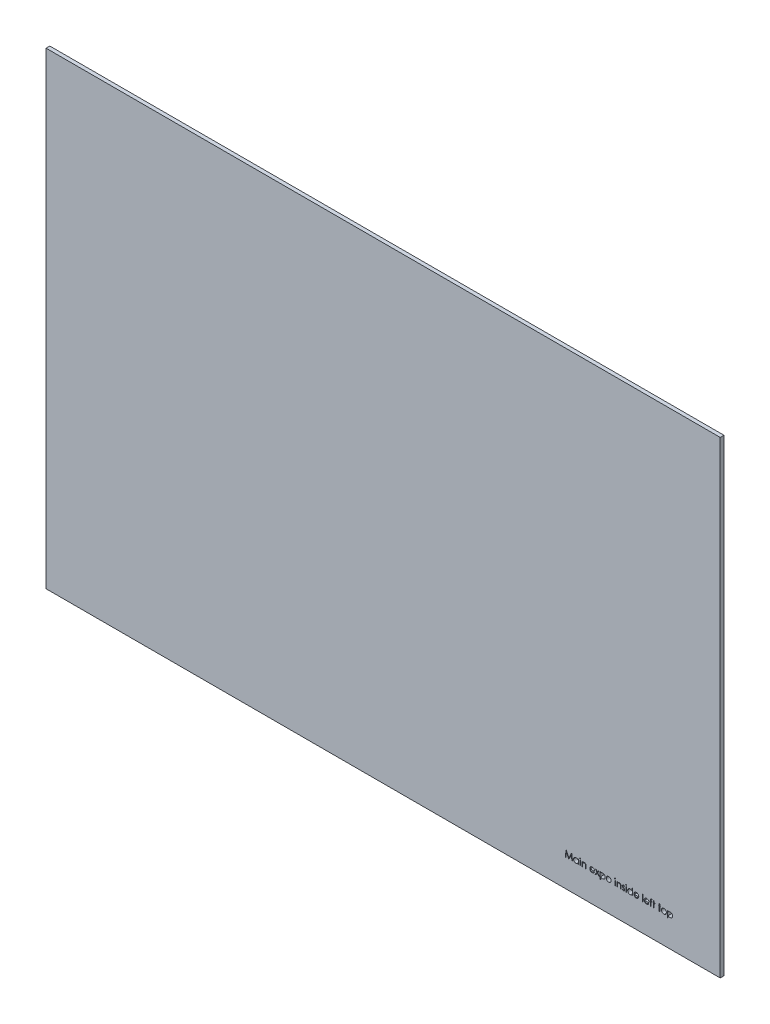
from build123d import *

# Parameters (mm, degrees)
SKETCH1_W           = 360
SKETCH1_H           = 250
BOSS_EXTRUDE1_DEPTH = 2
SKETCH2_W           = 0.314102564
SKETCH2_H           = 2.557692308
SKETCH2_H_2         = 3.58974359
CUT_EXTRUDE1_DEPTH  = 439.296703159


with BuildPart() as part:
    # Sketch1 → Boss-Extrude1 (new body)
    with BuildSketch(Plane.XY):
        with Locations((180, -125)):
            Rectangle(SKETCH1_W, SKETCH1_H)
    extrude(amount=BOSS_EXTRUDE1_DEPTH)

    # Sketch2 → Cut-Extrude1 (cut, through all)
    # profile 1 of 24: a face of its own
    with BuildSketch(Plane.XY.offset(2)):
        Polygon((277.252072298, -235.433998468), (277.714111561, -231.933998468), (277.758983356, -231.933998468), (279.203995375, -234.80579334), (280.645501786, -231.933998468), (280.691074702, -231.933998468), (281.155918452, -235.433998468), (280.840413645, -235.433998468), (280.505277427, -232.915568981), (279.241855952, -235.433998468), (279.171042651, -235.433998468), (277.902713324, -232.909960007), (277.568278228, -235.433998468), align=None)
    # profile 2 of 24: a face of its own
    with BuildSketch(Plane.XY.offset(2)):
        with BuildLine():
            Line((284.386687683, -232.87630616), (284.386687683, -235.433998468))
            Line((284.386687683, -235.433998468), (284.072585119, -235.433998468))
            Line((284.072585119, -235.433998468), (284.072585119, -234.991590616))
            add(Edge.make_bspline(
                [(284.072585119, -234.991590616), (284.005347564, -235.071041813), (283.896836613, -235.181571287), (283.730209022, -235.296205454), (283.601542743, -235.364396568), (283.466615537, -235.415520456), (283.276562681, -235.464940061), (283.128149824, -235.479677613), (283.027913645, -235.478870263)],
                knots=[0, 0, 0, 0, 0.262084975, 0.386269912, 0.507164597, 0.627300236, 0.748144942, 1, 1, 1, 1], degree=3))
            add(Edge.make_bspline(
                [(283.027913645, -235.478870263), (282.938884233, -235.478652163), (282.806617122, -235.467157755), (282.636550478, -235.426298283), (282.515276767, -235.384440708), (282.399604393, -235.328848321), (282.288544355, -235.262310223), (282.182671662, -235.183068527), (282.083600063, -235.092480738), (281.992368301, -234.99408569), (281.912306168, -234.889140147), (281.845556219, -234.778097885), (281.789724538, -234.662364559), (281.746771493, -234.541050289), (281.706094917, -234.370343108), (281.694587983, -234.237647452), (281.694379991, -234.148141096)],
                knots=[0, 0, 0, 0, 0.127433484, 0.189004127, 0.249930071, 0.310668454, 0.372328961, 0.43493911, 0.499575544, 0.564191208, 0.626735217, 0.688109334, 0.749293607, 0.810330528, 0.87190117, 1, 1, 1, 1], degree=3))
            add(Edge.make_bspline(
                [(281.694379991, -234.148141096), (281.694897644, -234.060323332), (281.705629119, -233.929708782), (281.74762495, -233.761976765), (281.791133917, -233.6426215), (281.846986264, -233.528281003), (281.914911523, -233.418877096), (281.994931434, -233.314107678), (282.087183624, -233.216436409), (282.187118445, -233.126215985), (282.294027191, -233.047806244), (282.405250366, -232.980091914), (282.522513782, -232.92642914), (282.644079362, -232.883054875), (282.815291997, -232.842375391), (282.948316117, -232.832231987), (283.03772935, -232.831434366)],
                knots=[0, 0, 0, 0, 0.12607881, 0.186904093, 0.247573935, 0.308003356, 0.369131898, 0.432033228, 0.496790794, 0.561610823, 0.624913866, 0.686726349, 0.748078833, 0.809582291, 0.871630743, 1, 1, 1, 1], degree=3))
            add(Edge.make_bspline(
                [(283.03772935, -232.831434366), (283.139922033, -232.831733335), (283.291665364, -232.8448534), (283.48366314, -232.898832335), (283.618326216, -232.952693968), (283.745462765, -233.024384784), (283.907385766, -233.147538925), (284.010655164, -233.2646055), (284.072585119, -233.349563372)],
                knots=[0, 0, 0, 0, 0.254653531, 0.376014554, 0.495255252, 0.614797719, 0.738105554, 1, 1, 1, 1], degree=3))
            Line((284.072585119, -233.349563372), (284.072585119, -232.87630616))
            Line((284.072585119, -232.87630616), (284.386687683, -232.87630616))
        make_face()
        with BuildLine():
            add(Edge.make_bspline(
                [(283.041936081, -233.14553693), (282.95143507, -233.145932168), (282.816059733, -233.160948644), (282.645034702, -233.217499023), (282.524091104, -233.274722843), (282.411422648, -233.346767088), (282.310727483, -233.433884314), (282.221191057, -233.533722615), (282.14585861, -233.645823734), (282.084557513, -233.766004447), (282.026697026, -233.933121454), (282.007328984, -234.064168549), (282.008482555, -234.151646705)],
                knots=[0, 0, 0, 0, 0.169593435, 0.252475515, 0.336244477, 0.419504521, 0.502035907, 0.584774648, 0.669846475, 0.754184866, 0.836658238, 1, 1, 1, 1], degree=3))
            add(Edge.make_bspline(
                [(282.008482555, -234.151646705), (282.009230547, -234.238555427), (282.025861954, -234.37008093), (282.085752876, -234.536882538), (282.146928248, -234.658141381), (282.223632911, -234.770725695), (282.312516833, -234.8724671), (282.414468441, -234.959951376), (282.527395322, -235.033209137), (282.648004451, -235.092296561), (282.817472942, -235.147668801), (282.950229177, -235.165187366), (283.039131593, -235.164767699)],
                knots=[0, 0, 0, 0, 0.162858895, 0.245483689, 0.330807139, 0.416493374, 0.499893203, 0.583048156, 0.667157852, 0.751311929, 0.833784789, 1, 1, 1, 1], degree=3))
            add(Edge.make_bspline(
                [(283.039131593, -235.164767699), (283.129443968, -235.164380238), (283.265068544, -235.148756764), (283.437901623, -235.092706986), (283.561687299, -235.034870204), (283.677003577, -234.963096296), (283.780502374, -234.879093414), (283.868014621, -234.781389392), (283.94222124, -234.674012206), (284.000343908, -234.556304006), (284.057878075, -234.386914004), (284.072103378, -234.251428565), (284.072585119, -234.160761289)],
                knots=[0, 0, 0, 0, 0.16866354, 0.252551924, 0.338239689, 0.423102661, 0.505556051, 0.586175656, 0.66713572, 0.74849918, 0.830452399, 1, 1, 1, 1], degree=3))
            add(Edge.make_bspline(
                [(284.072585119, -234.160761289), (284.072388303, -234.091233736), (284.063537475, -233.988177955), (284.032325324, -233.856005748), (284.000011707, -233.762563607), (283.957511767, -233.673928447), (283.906266338, -233.589464721), (283.84536025, -233.509611516), (283.775777732, -233.435468384), (283.699612476, -233.367842157), (283.619017968, -233.307477058), (283.533039145, -233.257891426), (283.443122377, -233.21683853), (283.349110027, -233.184223488), (283.215482041, -233.154547184), (283.112034639, -233.144518263), (283.041936081, -233.14553693)],
                knots=[0, 0, 0, 0, 0.129188088, 0.191218683, 0.251912818, 0.312507474, 0.373494434, 0.4351516, 0.498741474, 0.562095217, 0.624186567, 0.685475718, 0.746096815, 0.807611636, 0.869966581, 1, 1, 1, 1], degree=3))
        make_face(mode=Mode.SUBTRACT)
    # profile 3 of 24: a face of its own
    with BuildSketch(Plane.XY.offset(2)):
        with Locations((285.216815888, -234.155152314)):
            Rectangle(SKETCH2_W, SKETCH2_H)
    # profile 4 of 24: a face of its own
    with BuildSketch(Plane.XY.offset(2)):
        with BuildLine():
            Line((286.136687683, -232.87630616), (286.450790247, -232.87630616))
            Line((286.450790247, -232.87630616), (286.450790247, -233.337644301))
            add(Edge.make_bspline(
                [(286.450790247, -233.337644301), (286.514147051, -233.25543704), (286.615041829, -233.140516436), (286.772360868, -233.019955617), (286.892333415, -232.949820178), (287.017961898, -232.897028935), (287.193463826, -232.845438335), (287.33149762, -232.831910606), (287.423947298, -232.831434366)],
                knots=[0, 0, 0, 0, 0.273568781, 0.398988314, 0.519929781, 0.638110022, 0.756588901, 1, 1, 1, 1], degree=3))
            add(Edge.make_bspline(
                [(287.423947298, -232.831434366), (287.516322944, -232.832046141), (287.654199084, -232.847048615), (287.824770884, -232.909800423), (287.941385343, -232.972957906), (288.046513904, -233.051578813), (288.138838404, -233.143152808), (288.215201738, -233.248489907), (288.266399104, -233.346212811), (288.300124696, -233.432901641), (288.321357242, -233.507148383), (288.33938733, -233.589866537), (288.355022902, -233.680806125), (288.365583866, -233.780604317), (288.377216634, -233.930330894), (288.381057379, -234.047121861), (288.380277427, -234.127808564)],
                knots=[0, 0, 0, 0, 0.15117814, 0.223487984, 0.295542644, 0.366976255, 0.437130525, 0.507043616, 0.578559734, 0.616613545, 0.658756237, 0.704491226, 0.754803115, 0.809331625, 0.868274455, 1, 1, 1, 1], degree=3))
            Line((288.380277427, -234.127808564), (288.380277427, -235.433998468))
            Line((288.380277427, -235.433998468), (288.066174863, -235.433998468))
            Line((288.066174863, -235.433998468), (288.066174863, -234.230873468))
            add(Edge.make_bspline(
                [(288.066174863, -234.230873468), (288.065680291, -234.16427042), (288.065568922, -234.068879221), (288.061636602, -233.947586263), (288.057692739, -233.870187622), (288.051894853, -233.801957971), (288.044543122, -233.728961441), (288.036078042, -233.678998304), (288.029015407, -233.648942378)],
                knots=[0, 0, 0, 0, 0.342109649, 0.489825663, 0.623254428, 0.740079676, 0.841482673, 1, 1, 1, 1], degree=3))
            add(Edge.make_bspline(
                [(288.029015407, -233.648942378), (288.011493106, -233.572135737), (287.971817116, -233.462512204), (287.883551098, -233.340934746), (287.80570302, -233.268738861), (287.71446361, -233.212618057), (287.57004292, -233.15839414), (287.450911165, -233.145072792), (287.369259798, -233.14553693)],
                knots=[0, 0, 0, 0, 0.260833163, 0.378476029, 0.493177646, 0.609280965, 0.729981038, 1, 1, 1, 1], degree=3))
            add(Edge.make_bspline(
                [(287.369259798, -233.14553693), (287.319284658, -233.145297779), (287.244550872, -233.15099262), (287.147913417, -233.171883458), (287.077493792, -233.192728256), (287.009985841, -233.221396964), (286.94322159, -233.25392459), (286.879714823, -233.294473283), (286.818111395, -233.339663764), (286.760798713, -233.389743039), (286.70746992, -233.442587423), (286.659933563, -233.498863458), (286.61685878, -233.557661831), (286.579703038, -233.619799473), (286.536181505, -233.706531545), (286.511756953, -233.775563735), (286.499167651, -233.822820584)],
                knots=[0, 0, 0, 0, 0.126626858, 0.188984372, 0.250230194, 0.312351163, 0.374573618, 0.438147531, 0.502920413, 0.567974095, 0.630771334, 0.692934609, 0.754397534, 0.815218352, 0.876116925, 1, 1, 1, 1], degree=3))
            add(Edge.make_bspline(
                [(286.499167651, -233.822820584), (286.489812337, -233.860218352), (286.479374538, -233.921693875), (286.469001861, -234.010598345), (286.461937675, -234.091484798), (286.457638444, -234.182244275), (286.451086234, -234.322403713), (286.451258663, -234.432575302), (286.450790247, -234.509218821)],
                knots=[0, 0, 0, 0, 0.167615077, 0.271052394, 0.389459503, 0.520842802, 0.666398759, 1, 1, 1, 1], degree=3))
            Line((286.450790247, -234.509218821), (286.450790247, -235.433998468))
            Line((286.450790247, -235.433998468), (286.136687683, -235.433998468))
            Line((286.136687683, -235.433998468), (286.136687683, -232.87630616))
        make_face()
    # profile 5 of 24: a face of its own
    with BuildSketch(Plane.XY.offset(2)):
        with BuildLine():
            Line((292.543538645, -234.62630616), (292.822585119, -234.772840616))
            add(Edge.make_bspline(
                [(292.822585119, -234.772840616), (292.781084283, -234.85053325), (292.711613292, -234.959529136), (292.604667408, -235.089291291), (292.519594415, -235.171037709), (292.429916809, -235.242284658), (292.335186222, -235.304624175), (292.234896907, -235.357740257), (292.12904709, -235.402500949), (292.016748441, -235.436879184), (291.854365168, -235.470204882), (291.727488686, -235.478859103), (291.641194895, -235.478870263)],
                knots=[0, 0, 0, 0, 0.181660766, 0.265874227, 0.346354784, 0.424599862, 0.501903184, 0.579992091, 0.658443431, 0.738672236, 0.821894148, 1, 1, 1, 1], degree=3))
            add(Edge.make_bspline(
                [(291.641194895, -235.478870263), (291.545424215, -235.47883138), (291.404502519, -235.467835097), (291.225270676, -235.424688742), (291.102060624, -235.380763068), (290.987317946, -235.323325441), (290.880817201, -235.253368692), (290.781997656, -235.171235697), (290.693973411, -235.076219453), (290.614729692, -234.97453745), (290.544803272, -234.868581549), (290.486348014, -234.758618433), (290.438787434, -234.645347499), (290.400412037, -234.529485124), (290.364330753, -234.36903798), (290.355551128, -234.245186173), (290.354636401, -234.162163532)],
                knots=[0, 0, 0, 0, 0.139629225, 0.204796697, 0.268134963, 0.329813747, 0.391301398, 0.453433515, 0.51655169, 0.579631271, 0.641118921, 0.701294047, 0.760810336, 0.819931722, 0.878919575, 1, 1, 1, 1], degree=3))
            add(Edge.make_bspline(
                [(290.354636401, -234.162163532), (290.355589689, -234.08436983), (290.362865769, -233.96824097), (290.394493149, -233.817697259), (290.426640582, -233.708809567), (290.468219683, -233.603269317), (290.53639246, -233.465758281), (290.601556292, -233.36968901), (290.649107555, -233.308197186)],
                knots=[0, 0, 0, 0, 0.2537679, 0.377428427, 0.500550841, 0.623295883, 0.746578332, 1, 1, 1, 1], degree=3))
            add(Edge.make_bspline(
                [(290.649107555, -233.308197186), (290.709680615, -233.232472637), (290.808448591, -233.126590802), (290.963110743, -233.015828275), (291.084687766, -232.947788729), (291.2150292, -232.896156199), (291.401575226, -232.843661797), (291.549451023, -232.832632946), (291.648907234, -232.831434366)],
                knots=[0, 0, 0, 0, 0.253589335, 0.374643257, 0.495340042, 0.616324775, 0.739759335, 1, 1, 1, 1], degree=3))
            add(Edge.make_bspline(
                [(291.648907234, -232.831434366), (291.751734736, -232.831002392), (291.903642997, -232.845882598), (292.09623606, -232.899171848), (292.230080406, -232.954257479), (292.355749917, -233.025469226), (292.514025093, -233.144540011), (292.617468007, -233.254179702), (292.678855151, -233.334839814)],
                knots=[0, 0, 0, 0, 0.259032841, 0.381879824, 0.502258444, 0.62275219, 0.744742632, 1, 1, 1, 1], degree=3))
            add(Edge.make_bspline(
                [(292.678855151, -233.334839814), (292.724741803, -233.393728638), (292.784650843, -233.489367801), (292.848261611, -233.626153823), (292.886638389, -233.735035557), (292.917648522, -233.848861907), (292.948250005, -234.011218026), (292.955611039, -234.137200365), (292.957200504, -234.222460007)],
                knots=[0, 0, 0, 0, 0.236254763, 0.356174434, 0.477249655, 0.601539871, 0.729618382, 1, 1, 1, 1], degree=3))
            Line((292.957200504, -234.222460007), (290.668738965, -234.222460007))
            add(Edge.make_bspline(
                [(290.668738965, -234.222460007), (290.67052769, -234.288706018), (290.679408036, -234.386562276), (290.709688567, -234.511775567), (290.740934332, -234.598858147), (290.778807246, -234.681788394), (290.825191343, -234.759950402), (290.880531336, -234.832988328), (290.942256915, -234.901555514), (291.010964045, -234.962616086), (291.083246774, -235.017268551), (291.160140376, -235.063071625), (291.241038329, -235.100260887), (291.325810604, -235.129331959), (291.445792669, -235.156398419), (291.53892092, -235.165117383), (291.601932074, -235.164767699)],
                knots=[0, 0, 0, 0, 0.134475588, 0.198391058, 0.260753477, 0.321829223, 0.383037238, 0.444653123, 0.507398011, 0.569825238, 0.630777641, 0.690928687, 0.750945133, 0.811049477, 0.872330853, 1, 1, 1, 1], degree=3))
            add(Edge.make_bspline(
                [(291.601932074, -235.164767699), (291.664125978, -235.16506853), (291.75742221, -235.157745468), (291.879270504, -235.132225886), (291.968531247, -235.10636761), (292.054102059, -235.074782379), (292.133347957, -235.036681866), (292.206226901, -234.994530724), (292.27434852, -234.946324367), (292.34040036, -234.887303041), (292.433898149, -234.78248411), (292.501013919, -234.692853644), (292.543538645, -234.62630616)],
                knots=[0, 0, 0, 0, 0.163878894, 0.24565874, 0.327725695, 0.408609961, 0.485749086, 0.559169056, 0.630268476, 0.705306028, 0.792064966, 1, 1, 1, 1], degree=3))
        make_face()
        with BuildLine():
            Line((290.70169169, -233.908357442), (292.64309794, -233.908357442))
            add(Edge.make_bspline(
                [(292.64309794, -233.908357442), (292.623224141, -233.827616428), (292.583608764, -233.713695164), (292.511137377, -233.576785229), (292.449551664, -233.491196677), (292.379723652, -233.415195713), (292.299081057, -233.348775454), (292.208644296, -233.2893623), (292.108885953, -233.239193448), (292.00324184, -233.19656596), (291.855434359, -233.158000037), (291.74147544, -233.144395933), (291.665033036, -233.14553693)],
                knots=[0, 0, 0, 0, 0.185231261, 0.267500523, 0.344400382, 0.419594869, 0.496890627, 0.576637919, 0.660267852, 0.745386615, 0.830040327, 1, 1, 1, 1], degree=3))
            add(Edge.make_bspline(
                [(291.665033036, -233.14553693), (291.603107678, -233.145384792), (291.511073785, -233.152081496), (291.392731618, -233.177809142), (291.308023791, -233.203744809), (291.227415488, -233.238371378), (291.122395461, -233.292786961), (291.051495418, -233.34702957), (291.005978548, -233.385320584)],
                knots=[0, 0, 0, 0, 0.259141276, 0.384161763, 0.505991952, 0.629098089, 0.750669123, 1, 1, 1, 1], degree=3))
            add(Edge.make_bspline(
                [(291.005978548, -233.385320584), (290.971097869, -233.414703098), (290.923891495, -233.465585268), (290.867161999, -233.540364537), (290.827799294, -233.603381241), (290.791741012, -233.672012836), (290.745522782, -233.772632681), (290.718125896, -233.8530256), (290.70169169, -233.908357442)],
                knots=[0, 0, 0, 0, 0.222580497, 0.338499871, 0.458708565, 0.585535346, 0.717517743, 1, 1, 1, 1], degree=3))
        make_face(mode=Mode.SUBTRACT)
    # profile 6 of 24: a face of its own
    with BuildSketch(Plane.XY.offset(2)):
        Polygon((293.361046657, -232.87630616), (293.734744574, -232.87630616), (294.39309794, -233.798982442), (295.051451305, -232.87630616), (295.425149222, -232.87630616), (294.580297459, -234.060500872), (295.559764606, -235.433998468), (295.18606669, -235.433998468), (294.39309794, -234.322720423), (293.60012919, -235.433998468), (293.226431273, -235.433998468), (294.206599542, -234.060500872), align=None)
    # profile 7 of 24: a face of its own
    with BuildSketch(Plane.XY.offset(2)):
        with BuildLine():
            Line((295.918738965, -232.87630616), (296.232841529, -232.87630616))
            Line((296.232841529, -232.87630616), (296.232841529, -233.349563372))
            add(Edge.make_bspline(
                [(296.232841529, -233.349563372), (296.295006765, -233.264253924), (296.399434457, -233.148320345), (296.560712535, -233.024149105), (296.687828306, -232.95271954), (296.822261513, -232.898955783), (297.013496673, -232.844806581), (297.164574391, -232.831755813), (297.266295055, -232.831434366)],
                knots=[0, 0, 0, 0, 0.263044683, 0.386061082, 0.505770653, 0.625178031, 0.746147722, 1, 1, 1, 1], degree=3))
            add(Edge.make_bspline(
                [(297.266295055, -232.831434366), (297.355927786, -232.832332488), (297.489211404, -232.842292227), (297.660645498, -232.883060247), (297.782211857, -232.926427751), (297.899475373, -232.980092138), (298.010697354, -233.047806757), (298.117610929, -233.126213615), (298.217527167, -233.216445584), (298.309848318, -233.31407389), (298.389695288, -233.419096215), (298.45856435, -233.528058686), (298.514245066, -233.642651213), (298.557814455, -233.761968814), (298.599788689, -233.929714292), (298.610533583, -234.060320478), (298.611046657, -234.148141096)],
                knots=[0, 0, 0, 0, 0.128636051, 0.190652902, 0.252125037, 0.313446276, 0.375227279, 0.438498083, 0.5032851, 0.568009687, 0.630878982, 0.692153504, 0.75255215, 0.813191094, 0.8739854, 1, 1, 1, 1], degree=3))
            add(Edge.make_bspline(
                [(298.611046657, -234.148141096), (298.610843418, -234.237650347), (298.599322605, -234.370337551), (298.558668236, -234.541058254), (298.515653432, -234.662334917), (298.460000315, -234.778318729), (298.392298901, -234.888925085), (298.31241157, -234.994118784), (298.221110681, -235.092471744), (298.122057686, -235.183070825), (298.016180192, -235.262309731), (297.905121339, -235.328848066), (297.789448892, -235.384442187), (297.668174304, -235.426292569), (297.497887178, -235.467243354), (297.365358371, -235.478547546), (297.27611076, -235.478870263)],
                knots=[0, 0, 0, 0, 0.128034164, 0.189573725, 0.250579835, 0.311733221, 0.37325008, 0.435762516, 0.500345561, 0.564949367, 0.627527909, 0.68915729, 0.749865012, 0.8107602, 0.872299761, 1, 1, 1, 1], degree=3))
            add(Edge.make_bspline(
                [(297.27611076, -235.478870263), (297.175640552, -235.480030176), (297.027136757, -235.462866983), (296.836812378, -235.41030167), (296.702610857, -235.353683701), (296.574478525, -235.281381711), (296.409415466, -235.161881604), (296.300382859, -235.050696238), (296.232841529, -234.970556962)],
                knots=[0, 0, 0, 0, 0.250547782, 0.371230204, 0.49211577, 0.613400988, 0.73799732, 1, 1, 1, 1], degree=3))
            Line((296.232841529, -234.970556962), (296.232841529, -236.37630616))
            Line((296.232841529, -236.37630616), (295.918738965, -236.37630616))
            Line((295.918738965, -236.37630616), (295.918738965, -232.87630616))
        make_face()
        with BuildLine():
            add(Edge.make_bspline(
                [(297.263490568, -233.14553693), (297.193384918, -233.144503983), (297.08995817, -233.154574499), (296.956297269, -233.184184516), (296.862174182, -233.217052006), (296.771923867, -233.257462565), (296.686239618, -233.307941426), (296.605182085, -233.367594299), (296.528955001, -233.435273406), (296.460091885, -233.509848155), (296.399128319, -233.589435958), (296.347923351, -233.673936062), (296.305412676, -233.76256157), (296.273101943, -233.856006304), (296.241888739, -233.988177565), (296.233038572, -234.09123394), (296.232841529, -234.160761289)],
                knots=[0, 0, 0, 0, 0.130023749, 0.192374057, 0.253884304, 0.314896085, 0.375805828, 0.438242236, 0.501591268, 0.56488076, 0.626533341, 0.687515765, 0.748105916, 0.808795537, 0.870821519, 1, 1, 1, 1], degree=3))
            add(Edge.make_bspline(
                [(296.232841529, -234.160761289), (296.23300873, -234.25153816), (296.24813977, -234.386630774), (296.304167541, -234.556464979), (296.362638152, -234.673924104), (296.436601196, -234.781907155), (296.525695203, -234.878598806), (296.629138841, -234.963384886), (296.745205926, -235.034823778), (296.869627345, -235.092745364), (297.042779285, -235.148453572), (297.178267061, -235.164598134), (297.26839842, -235.164767699)],
                knots=[0, 0, 0, 0, 0.169344011, 0.251060671, 0.332326431, 0.413189279, 0.494299499, 0.57665388, 0.661784919, 0.74776493, 0.831967435, 1, 1, 1, 1], degree=3))
            add(Edge.make_bspline(
                [(297.26839842, -235.164767699), (297.356879233, -235.165303991), (297.489052464, -235.147407805), (297.657976989, -235.092477999), (297.778159069, -235.032995951), (297.890981752, -234.959985003), (297.992864592, -234.872430447), (298.081867117, -234.770939288), (298.15774812, -234.657930131), (298.218817902, -234.536758587), (298.280070871, -234.370334987), (298.295939389, -234.238468247), (298.296944093, -234.151646705)],
                knots=[0, 0, 0, 0, 0.165573796, 0.248158777, 0.332033307, 0.416257349, 0.49952535, 0.58303856, 0.668595904, 0.75403535, 0.8369197, 1, 1, 1, 1], degree=3))
            add(Edge.make_bspline(
                [(298.296944093, -234.151646705), (298.298175628, -234.064126392), (298.278573843, -233.933205688), (298.221072638, -233.765775185), (298.158604624, -233.646251202), (298.084378818, -233.533478327), (297.994638196, -233.433923105), (297.894020477, -233.346756606), (297.781331083, -233.274725681), (297.660393124, -233.217498273), (297.489366113, -233.160949154), (297.353991992, -233.145931904), (297.263490568, -233.14553693)],
                knots=[0, 0, 0, 0, 0.163349297, 0.245826474, 0.33036716, 0.415198374, 0.497940932, 0.580476126, 0.663740011, 0.747512837, 0.830398741, 1, 1, 1, 1], degree=3))
        make_face(mode=Mode.SUBTRACT)
    # profile 8 of 24: a face of its own
    with BuildSketch(Plane.XY.offset(2)):
        with Locations((303.883482555, -234.155152314)):
            Rectangle(SKETCH2_W, SKETCH2_H)
    # profile 9 of 24: a face of its own
    with BuildSketch(Plane.XY.offset(2)):
        with BuildLine():
            Line((304.80335435, -232.87630616), (305.117456914, -232.87630616))
            Line((305.117456914, -232.87630616), (305.117456914, -233.337644301))
            add(Edge.make_bspline(
                [(305.117456914, -233.337644301), (305.180813718, -233.25543704), (305.281708496, -233.140516436), (305.439027535, -233.019955617), (305.559000081, -232.949820178), (305.684628564, -232.897028935), (305.860130493, -232.845438335), (305.998164287, -232.831910606), (306.090613965, -232.831434366)],
                knots=[0, 0, 0, 0, 0.273568781, 0.398988314, 0.519929781, 0.638110022, 0.756588901, 1, 1, 1, 1], degree=3))
            add(Edge.make_bspline(
                [(306.090613965, -232.831434366), (306.182989611, -232.832046141), (306.320865751, -232.847048615), (306.491437551, -232.909800423), (306.60805201, -232.972957906), (306.71318057, -233.051578813), (306.80550507, -233.143152808), (306.881868404, -233.248489907), (306.93306577, -233.346212811), (306.966791363, -233.432901641), (306.988023908, -233.507148383), (307.006053996, -233.589866537), (307.021689568, -233.680806125), (307.032250533, -233.780604317), (307.043883301, -233.930330894), (307.047724046, -234.047121861), (307.046944093, -234.127808564)],
                knots=[0, 0, 0, 0, 0.15117814, 0.223487984, 0.295542644, 0.366976255, 0.437130525, 0.507043616, 0.578559734, 0.616613545, 0.658756237, 0.704491226, 0.754803115, 0.809331625, 0.868274455, 1, 1, 1, 1], degree=3))
            Line((307.046944093, -234.127808564), (307.046944093, -235.433998468))
            Line((307.046944093, -235.433998468), (306.732841529, -235.433998468))
            Line((306.732841529, -235.433998468), (306.732841529, -234.230873468))
            add(Edge.make_bspline(
                [(306.732841529, -234.230873468), (306.732346957, -234.16427042), (306.732235589, -234.068879221), (306.728303268, -233.947586263), (306.724359405, -233.870187622), (306.718561519, -233.801957971), (306.711209789, -233.728961441), (306.702744709, -233.678998304), (306.695682074, -233.648942378)],
                knots=[0, 0, 0, 0, 0.342109649, 0.489825663, 0.623254428, 0.740079676, 0.841482673, 1, 1, 1, 1], degree=3))
            add(Edge.make_bspline(
                [(306.695682074, -233.648942378), (306.678159773, -233.572135737), (306.638483782, -233.462512204), (306.550217764, -233.340934746), (306.472369687, -233.268738861), (306.381130276, -233.212618057), (306.236709586, -233.15839414), (306.117577832, -233.145072792), (306.035926465, -233.14553693)],
                knots=[0, 0, 0, 0, 0.260833163, 0.378476029, 0.493177646, 0.609280965, 0.729981038, 1, 1, 1, 1], degree=3))
            add(Edge.make_bspline(
                [(306.035926465, -233.14553693), (305.985951325, -233.145297779), (305.911217539, -233.15099262), (305.814580083, -233.171883458), (305.744160459, -233.192728256), (305.676652508, -233.221396964), (305.609888257, -233.25392459), (305.54638149, -233.294473283), (305.484778062, -233.339663764), (305.42746538, -233.389743039), (305.374136587, -233.442587423), (305.32660023, -233.498863458), (305.283525447, -233.557661831), (305.246369705, -233.619799473), (305.202848171, -233.706531545), (305.17842362, -233.775563735), (305.165834318, -233.822820584)],
                knots=[0, 0, 0, 0, 0.126626858, 0.188984372, 0.250230194, 0.312351163, 0.374573618, 0.438147531, 0.502920413, 0.567974095, 0.630771334, 0.692934609, 0.754397534, 0.815218352, 0.876116925, 1, 1, 1, 1], degree=3))
            add(Edge.make_bspline(
                [(305.165834318, -233.822820584), (305.156479004, -233.860218352), (305.146041204, -233.921693875), (305.135668528, -234.010598345), (305.128604341, -234.091484798), (305.124305111, -234.182244275), (305.1177529, -234.322403713), (305.11792533, -234.432575302), (305.117456914, -234.509218821)],
                knots=[0, 0, 0, 0, 0.167615077, 0.271052394, 0.389459503, 0.520842802, 0.666398759, 1, 1, 1, 1], degree=3))
            Line((305.117456914, -234.509218821), (305.117456914, -235.433998468))
            Line((305.117456914, -235.433998468), (304.80335435, -235.433998468))
            Line((304.80335435, -235.433998468), (304.80335435, -232.87630616))
        make_face()
    # profile 10 of 24: a face of its own
    with BuildSketch(Plane.XY.offset(2)):
        with BuildLine():
            Line((308.976431273, -233.195316577), (308.763290247, -233.414767699))
            add(Edge.make_bspline(
                [(308.763290247, -233.414767699), (308.728472926, -233.373238672), (308.675003929, -233.315294445), (308.597181854, -233.251299794), (308.54214323, -233.212327975), (308.48668181, -233.182923425), (308.414618902, -233.154677798), (308.35839839, -233.145569695), (308.321583516, -233.14553693)],
                knots=[0, 0, 0, 0, 0.305035505, 0.441308964, 0.565963227, 0.683525114, 0.79333413, 1, 1, 1, 1], degree=3))
            add(Edge.make_bspline(
                [(308.321583516, -233.14553693), (308.277933739, -233.144642186), (308.212827318, -233.158735189), (308.13550467, -233.202301707), (308.085332363, -233.248203655), (308.042895258, -233.300984199), (308.001207693, -233.379838059), (307.989375278, -233.445843079), (307.989251786, -233.489787731)],
                knots=[0, 0, 0, 0, 0.245900629, 0.36916603, 0.498510841, 0.628503866, 0.751028329, 1, 1, 1, 1], degree=3))
            add(Edge.make_bspline(
                [(307.989251786, -233.489787731), (307.989327302, -233.530153264), (308.005013445, -233.614297104), (308.049500699, -233.687329993), (308.076190888, -233.721859045)],
                knots=[0, 0, 0, 0, 0.479403194, 1, 1, 1, 1], degree=3))
            add(Edge.make_bspline(
                [(308.076190888, -233.721859045), (308.092173398, -233.743573534), (308.123382446, -233.773108554), (308.168959129, -233.813292258), (308.212245678, -233.84526117), (308.261013991, -233.878871074), (308.337860709, -233.926282301), (308.398053256, -233.962869708), (308.441475343, -233.98548084)],
                knots=[0, 0, 0, 0, 0.177559821, 0.28398236, 0.402216747, 0.53356848, 0.676120994, 1, 1, 1, 1], degree=3))
            add(Edge.make_bspline(
                [(308.441475343, -233.98548084), (308.494195272, -234.014610989), (308.570048555, -234.058489258), (308.663732841, -234.121320271), (308.725197767, -234.165977558), (308.779116347, -234.211147808), (308.840811864, -234.267350093), (308.87994773, -234.313158855), (308.902112363, -234.344455199)],
                knots=[0, 0, 0, 0, 0.307114592, 0.446213159, 0.574876072, 0.69415211, 0.80458118, 1, 1, 1, 1], degree=3))
            add(Edge.make_bspline(
                [(308.902112363, -234.344455199), (308.940166592, -234.40198943), (309.004243445, -234.528640577), (309.020302063, -234.669643965), (309.021303068, -234.739887891)],
                knots=[0, 0, 0, 0, 0.495235025, 1, 1, 1, 1], degree=3))
            add(Edge.make_bspline(
                [(309.021303068, -234.739887891), (309.020831165, -234.789615834), (309.015333144, -234.863690369), (308.992338077, -234.958423074), (308.969262724, -235.026117043), (308.938073399, -235.090076336), (308.901526933, -235.151912492), (308.857651655, -235.210288442), (308.80756038, -235.265127423), (308.752714863, -235.315213067), (308.694208717, -235.359237402), (308.631969939, -235.395810341), (308.566442934, -235.426080923), (308.497480056, -235.45012926), (308.399487854, -235.472780755), (308.323193355, -235.478520164), (308.271803869, -235.478870263)],
                knots=[0, 0, 0, 0, 0.127199133, 0.188597338, 0.248639515, 0.309524699, 0.370036991, 0.431889244, 0.495704286, 0.559519328, 0.62137158, 0.682397107, 0.743568482, 0.805498484, 0.868639701, 1, 1, 1, 1], degree=3))
            add(Edge.make_bspline(
                [(308.271803869, -235.478870263), (308.201543859, -235.479403282), (308.09634503, -235.467277542), (307.960785893, -235.428560504), (307.862390897, -235.388906916), (307.769385873, -235.338709032), (307.656145011, -235.259117374), (307.582801628, -235.186114998), (307.540533837, -235.132516096)],
                knots=[0, 0, 0, 0, 0.251723961, 0.377218688, 0.504693549, 0.631458239, 0.755401067, 1, 1, 1, 1], degree=3))
            Line((307.540533837, -235.132516096), (307.74876701, -234.89553693))
            add(Edge.make_bspline(
                [(307.74876701, -234.89553693), (307.786416931, -234.937432024), (307.844710275, -234.996121516), (307.930561132, -235.059607412), (307.993384059, -235.098270851), (308.057607834, -235.128003166), (308.144069569, -235.155920443), (308.211221885, -235.164982886), (308.255678068, -235.164767699)],
                knots=[0, 0, 0, 0, 0.285904172, 0.417171648, 0.540500744, 0.659237718, 0.775006098, 1, 1, 1, 1], degree=3))
            add(Edge.make_bspline(
                [(308.255678068, -235.164767699), (308.314886275, -235.165280129), (308.402705923, -235.149992901), (308.508410423, -235.098220146), (308.576455135, -235.0442003), (308.634278294, -234.981228042), (308.690414985, -234.886906735), (308.707531759, -234.806427766), (308.707200504, -234.753209205)],
                knots=[0, 0, 0, 0, 0.261895674, 0.387836045, 0.517686206, 0.644508654, 0.764718263, 1, 1, 1, 1], degree=3))
            add(Edge.make_bspline(
                [(308.707200504, -234.753209205), (308.707033153, -234.709239587), (308.693041618, -234.620949348), (308.648852045, -234.54316953), (308.620962523, -234.509218821)],
                knots=[0, 0, 0, 0, 0.500453315, 1, 1, 1, 1], degree=3))
            add(Edge.make_bspline(
                [(308.620962523, -234.509218821), (308.604115526, -234.488951591), (308.572916081, -234.459543442), (308.525010243, -234.421454026), (308.47989311, -234.389100421), (308.427893661, -234.355513704), (308.345237481, -234.306908814), (308.279612063, -234.270054028), (308.23324217, -234.245597026)],
                knots=[0, 0, 0, 0, 0.167461676, 0.272270023, 0.389550841, 0.520801368, 0.666263293, 1, 1, 1, 1], degree=3))
            add(Edge.make_bspline(
                [(308.23324217, -234.245597026), (308.182647954, -234.217629945), (308.109661314, -234.175942898), (308.020591165, -234.114274023), (307.961480717, -234.071371435), (307.90934848, -234.027927875), (307.851434753, -233.971562491), (307.813175641, -233.927505631), (307.792236561, -233.896438372)],
                knots=[0, 0, 0, 0, 0.305950213, 0.443775499, 0.572824362, 0.692154156, 0.802295707, 1, 1, 1, 1], degree=3))
            add(Edge.make_bspline(
                [(307.792236561, -233.896438372), (307.752967791, -233.840043578), (307.694593927, -233.71214509), (307.673877448, -233.573126998), (307.675149222, -233.502407923)],
                knots=[0, 0, 0, 0, 0.492590796, 1, 1, 1, 1], degree=3))
            add(Edge.make_bspline(
                [(307.675149222, -233.502407923), (307.67546601, -233.45626561), (307.679594461, -233.387630743), (307.70027563, -233.300055858), (307.719316742, -233.237930813), (307.745803363, -233.179428244), (307.777448302, -233.123770897), (307.814635989, -233.071034955), (307.857479208, -233.022031794), (307.904585874, -232.977522608), (307.955480634, -232.938723464), (308.009018908, -232.905618997), (308.065427267, -232.877846806), (308.125247968, -232.856872095), (308.210424972, -232.837128973), (308.276670455, -232.830899802), (308.321583516, -232.831434366)],
                knots=[0, 0, 0, 0, 0.133043535, 0.196507438, 0.258613417, 0.319728338, 0.380872854, 0.442635602, 0.505079304, 0.56788052, 0.628813854, 0.688910091, 0.748765006, 0.809385783, 0.870884336, 1, 1, 1, 1], degree=3))
            add(Edge.make_bspline(
                [(308.321583516, -232.831434366), (308.376478808, -232.831487554), (308.460361568, -232.843178822), (308.568256678, -232.881649388), (308.650585433, -232.921827311), (308.732373884, -232.973929088), (308.845880571, -233.060806791), (308.925823216, -233.138022009), (308.976431273, -233.195316577)],
                knots=[0, 0, 0, 0, 0.213411613, 0.32612673, 0.444451672, 0.56906108, 0.702712204, 1, 1, 1, 1], degree=3))
        make_face()
    # profile 11 of 24: a face of its own
    with BuildSketch(Plane.XY.offset(2)):
        with Locations((309.761687683, -234.155152314)):
            Rectangle(SKETCH2_W, SKETCH2_H)
    # profile 12 of 24: a face of its own
    with BuildSketch(Plane.XY.offset(2)):
        with BuildLine():
            Line((313.284123581, -231.844254878), (313.284123581, -235.433998468))
            Line((313.284123581, -235.433998468), (312.970021016, -235.433998468))
            Line((312.970021016, -235.433998468), (312.970021016, -234.991590616))
            add(Edge.make_bspline(
                [(312.970021016, -234.991590616), (312.902783461, -235.071041813), (312.79427251, -235.181571287), (312.62764492, -235.296205454), (312.498978641, -235.364396568), (312.364051434, -235.415520456), (312.173998578, -235.464940061), (312.025585722, -235.479677613), (311.925349542, -235.478870263)],
                knots=[0, 0, 0, 0, 0.262084975, 0.386269912, 0.507164597, 0.627300236, 0.748144942, 1, 1, 1, 1], degree=3))
            add(Edge.make_bspline(
                [(311.925349542, -235.478870263), (311.83632013, -235.478652163), (311.70405302, -235.467157755), (311.533986376, -235.426298283), (311.412712665, -235.384440708), (311.29704029, -235.328848321), (311.185980252, -235.262310223), (311.080107559, -235.183068527), (310.981035961, -235.092480738), (310.889804199, -234.99408569), (310.809742065, -234.889140147), (310.742992117, -234.778097885), (310.687160436, -234.662364559), (310.64420739, -234.541050289), (310.603530814, -234.370343108), (310.59202388, -234.237647452), (310.591815888, -234.148141096)],
                knots=[0, 0, 0, 0, 0.127433484, 0.189004127, 0.249930071, 0.310668454, 0.372328961, 0.43493911, 0.499575544, 0.564191208, 0.626735217, 0.688109334, 0.749293607, 0.810330528, 0.87190117, 1, 1, 1, 1], degree=3))
            add(Edge.make_bspline(
                [(310.591815888, -234.148141096), (310.592333542, -234.060323332), (310.603065017, -233.929708782), (310.645060848, -233.761976765), (310.688569815, -233.6426215), (310.744422161, -233.528281003), (310.81234742, -233.418877096), (310.892367331, -233.314107678), (310.984619521, -233.216436409), (311.084554342, -233.126215985), (311.191463088, -233.047806244), (311.302686263, -232.980091914), (311.41994968, -232.92642914), (311.54151526, -232.883054875), (311.712727894, -232.842375391), (311.845752015, -232.832231987), (311.935165247, -232.831434366)],
                knots=[0, 0, 0, 0, 0.12607881, 0.186904093, 0.247573935, 0.308003356, 0.369131898, 0.432033228, 0.496790794, 0.561610823, 0.624913866, 0.686726349, 0.748078833, 0.809582291, 0.871630743, 1, 1, 1, 1], degree=3))
            add(Edge.make_bspline(
                [(311.935165247, -232.831434366), (312.037483218, -232.831682277), (312.189726313, -232.846312161), (312.381564873, -232.904991027), (312.516062993, -232.964022802), (312.642428038, -233.040855664), (312.804678383, -233.16684793), (312.906687081, -233.286761064), (312.970021016, -233.371298148)],
                knots=[0, 0, 0, 0, 0.252984972, 0.374210437, 0.494101513, 0.614752763, 0.73851107, 1, 1, 1, 1], degree=3))
            Line((312.970021016, -233.371298148), (312.970021016, -231.844254878))
            Line((312.970021016, -231.844254878), (313.284123581, -231.844254878))
        make_face()
        with BuildLine():
            add(Edge.make_bspline(
                [(311.939371978, -233.14553693), (311.848870967, -233.145932168), (311.713495631, -233.160948644), (311.542470599, -233.217499023), (311.421527001, -233.274722843), (311.308858545, -233.346767088), (311.20816338, -233.433884314), (311.118626955, -233.533722615), (311.043294507, -233.645823734), (310.981993411, -233.766004447), (310.924132923, -233.933121454), (310.904764882, -234.064168549), (310.905918452, -234.151646705)],
                knots=[0, 0, 0, 0, 0.169593435, 0.252475515, 0.336244477, 0.419504521, 0.502035907, 0.584774648, 0.669846475, 0.754184866, 0.836658238, 1, 1, 1, 1], degree=3))
            add(Edge.make_bspline(
                [(310.905918452, -234.151646705), (310.906666445, -234.238555427), (310.923297852, -234.37008093), (310.983188774, -234.536882538), (311.044364146, -234.658141381), (311.121068809, -234.770725695), (311.209952731, -234.8724671), (311.311904338, -234.959951376), (311.42483122, -235.033209137), (311.545440348, -235.092296561), (311.714908839, -235.147668801), (311.847665075, -235.165187366), (311.936567491, -235.164767699)],
                knots=[0, 0, 0, 0, 0.162858895, 0.245483689, 0.330807139, 0.416493374, 0.499893203, 0.583048156, 0.667157852, 0.751311929, 0.833784789, 1, 1, 1, 1], degree=3))
            add(Edge.make_bspline(
                [(311.936567491, -235.164767699), (312.026879865, -235.164380238), (312.162504442, -235.148756764), (312.335337521, -235.092706986), (312.459123197, -235.034870204), (312.574439474, -234.963096296), (312.677938272, -234.879093414), (312.765450518, -234.781389392), (312.839657137, -234.674012206), (312.897779806, -234.556304006), (312.955313973, -234.386914004), (312.969539276, -234.251428565), (312.970021016, -234.160761289)],
                knots=[0, 0, 0, 0, 0.16866354, 0.252551924, 0.338239689, 0.423102661, 0.505556051, 0.586175656, 0.66713572, 0.74849918, 0.830452399, 1, 1, 1, 1], degree=3))
            add(Edge.make_bspline(
                [(312.970021016, -234.160761289), (312.969824201, -234.091233736), (312.960973372, -233.988177955), (312.929761222, -233.856005748), (312.897447605, -233.762563607), (312.854947664, -233.673928447), (312.803702236, -233.589464721), (312.742796147, -233.509611516), (312.673213629, -233.435468384), (312.597048374, -233.367842157), (312.516453865, -233.307477058), (312.430475043, -233.257891426), (312.340558274, -233.21683853), (312.246545924, -233.184223488), (312.112917939, -233.154547184), (312.009470537, -233.144518263), (311.939371978, -233.14553693)],
                knots=[0, 0, 0, 0, 0.129188088, 0.191218683, 0.251912818, 0.312507474, 0.373494434, 0.4351516, 0.498741474, 0.562095217, 0.624186567, 0.685475718, 0.746096815, 0.807611636, 0.869966581, 1, 1, 1, 1], degree=3))
        make_face(mode=Mode.SUBTRACT)
    # profile 13 of 24: a face of its own
    with BuildSketch(Plane.XY.offset(2)):
        with BuildLine():
            Line((316.101230952, -234.62630616), (316.380277427, -234.772840616))
            add(Edge.make_bspline(
                [(316.380277427, -234.772840616), (316.338776591, -234.85053325), (316.2693056, -234.959529136), (316.162359716, -235.089291291), (316.077286723, -235.171037709), (315.987609117, -235.242284658), (315.89287853, -235.304624175), (315.792589214, -235.357740257), (315.686739398, -235.402500949), (315.574440748, -235.436879184), (315.412057476, -235.470204882), (315.285180994, -235.478859103), (315.198887202, -235.478870263)],
                knots=[0, 0, 0, 0, 0.181660766, 0.265874227, 0.346354784, 0.424599862, 0.501903184, 0.579992091, 0.658443431, 0.738672236, 0.821894148, 1, 1, 1, 1], degree=3))
            add(Edge.make_bspline(
                [(315.198887202, -235.478870263), (315.103116522, -235.47883138), (314.962194827, -235.467835097), (314.782962984, -235.424688742), (314.659752932, -235.380763068), (314.545010253, -235.323325441), (314.438509509, -235.253368692), (314.339689964, -235.171235697), (314.251665718, -235.076219453), (314.172421999, -234.97453745), (314.10249558, -234.868581549), (314.044040321, -234.758618433), (313.996479741, -234.645347499), (313.958104345, -234.529485124), (313.92202306, -234.36903798), (313.913243436, -234.245186173), (313.912328709, -234.162163532)],
                knots=[0, 0, 0, 0, 0.139629225, 0.204796697, 0.268134963, 0.329813747, 0.391301398, 0.453433515, 0.51655169, 0.579631271, 0.641118921, 0.701294047, 0.760810336, 0.819931722, 0.878919575, 1, 1, 1, 1], degree=3))
            add(Edge.make_bspline(
                [(313.912328709, -234.162163532), (313.913281997, -234.08436983), (313.920558077, -233.96824097), (313.952185457, -233.817697259), (313.984332889, -233.708809567), (314.025911991, -233.603269317), (314.094084767, -233.465758281), (314.1592486, -233.36968901), (314.206799863, -233.308197186)],
                knots=[0, 0, 0, 0, 0.2537679, 0.377428427, 0.500550841, 0.623295883, 0.746578332, 1, 1, 1, 1], degree=3))
            add(Edge.make_bspline(
                [(314.206799863, -233.308197186), (314.267372923, -233.232472637), (314.366140898, -233.126590802), (314.52080305, -233.015828275), (314.642380073, -232.947788729), (314.772721508, -232.896156199), (314.959267534, -232.843661797), (315.107143331, -232.832632946), (315.206599542, -232.831434366)],
                knots=[0, 0, 0, 0, 0.253589335, 0.374643257, 0.495340042, 0.616324775, 0.739759335, 1, 1, 1, 1], degree=3))
            add(Edge.make_bspline(
                [(315.206599542, -232.831434366), (315.309427044, -232.831002392), (315.461335305, -232.845882598), (315.653928368, -232.899171848), (315.787772714, -232.954257479), (315.913442225, -233.025469226), (316.071717401, -233.144540011), (316.175160315, -233.254179702), (316.236547459, -233.334839814)],
                knots=[0, 0, 0, 0, 0.259032841, 0.381879824, 0.502258444, 0.62275219, 0.744742632, 1, 1, 1, 1], degree=3))
            add(Edge.make_bspline(
                [(316.236547459, -233.334839814), (316.282434111, -233.393728638), (316.342343151, -233.489367801), (316.405953919, -233.626153823), (316.444330697, -233.735035557), (316.47534083, -233.848861907), (316.505942313, -234.011218026), (316.513303347, -234.137200365), (316.514892811, -234.222460007)],
                knots=[0, 0, 0, 0, 0.236254763, 0.356174434, 0.477249655, 0.601539871, 0.729618382, 1, 1, 1, 1], degree=3))
            Line((316.514892811, -234.222460007), (314.226431273, -234.222460007))
            add(Edge.make_bspline(
                [(314.226431273, -234.222460007), (314.228219997, -234.288706018), (314.237100344, -234.386562276), (314.267380874, -234.511775567), (314.298626639, -234.598858147), (314.336499554, -234.681788394), (314.38288365, -234.759950402), (314.438223643, -234.832988328), (314.499949222, -234.901555514), (314.568656352, -234.962616086), (314.640939082, -235.017268551), (314.717832684, -235.063071625), (314.798730636, -235.100260887), (314.883502911, -235.129331959), (315.003484977, -235.156398419), (315.096613227, -235.165117383), (315.159624382, -235.164767699)],
                knots=[0, 0, 0, 0, 0.134475588, 0.198391058, 0.260753477, 0.321829223, 0.383037238, 0.444653123, 0.507398011, 0.569825238, 0.630777641, 0.690928687, 0.750945133, 0.811049477, 0.872330853, 1, 1, 1, 1], degree=3))
            add(Edge.make_bspline(
                [(315.159624382, -235.164767699), (315.221818286, -235.16506853), (315.315114518, -235.157745468), (315.436962812, -235.132225886), (315.526223555, -235.10636761), (315.611794367, -235.074782379), (315.691040265, -235.036681866), (315.763919209, -234.994530724), (315.832040828, -234.946324367), (315.898092668, -234.887303041), (315.991590457, -234.78248411), (316.058706226, -234.692853644), (316.101230952, -234.62630616)],
                knots=[0, 0, 0, 0, 0.163878894, 0.24565874, 0.327725695, 0.408609961, 0.485749086, 0.559169056, 0.630268476, 0.705306028, 0.792064966, 1, 1, 1, 1], degree=3))
        make_face()
        with BuildLine():
            Line((314.259383997, -233.908357442), (316.200790247, -233.908357442))
            add(Edge.make_bspline(
                [(316.200790247, -233.908357442), (316.180916448, -233.827616428), (316.141301072, -233.713695164), (316.068829685, -233.576785229), (316.007243972, -233.491196677), (315.93741596, -233.415195713), (315.856773365, -233.348775454), (315.766336603, -233.2893623), (315.666578261, -233.239193448), (315.560934147, -233.19656596), (315.413126667, -233.158000037), (315.299167748, -233.144395933), (315.222725343, -233.14553693)],
                knots=[0, 0, 0, 0, 0.185231261, 0.267500523, 0.344400382, 0.419594869, 0.496890627, 0.576637919, 0.660267852, 0.745386615, 0.830040327, 1, 1, 1, 1], degree=3))
            add(Edge.make_bspline(
                [(315.222725343, -233.14553693), (315.160799986, -233.145384792), (315.068766093, -233.152081496), (314.950423926, -233.177809142), (314.865716099, -233.203744809), (314.785107795, -233.238371378), (314.680087769, -233.292786961), (314.609187726, -233.34702957), (314.563670856, -233.385320584)],
                knots=[0, 0, 0, 0, 0.259141276, 0.384161763, 0.505991952, 0.629098089, 0.750669123, 1, 1, 1, 1], degree=3))
            add(Edge.make_bspline(
                [(314.563670856, -233.385320584), (314.528790177, -233.414703098), (314.481583803, -233.465585268), (314.424854307, -233.540364537), (314.385491602, -233.603381241), (314.34943332, -233.672012836), (314.303215089, -233.772632681), (314.275818203, -233.8530256), (314.259383997, -233.908357442)],
                knots=[0, 0, 0, 0, 0.222580497, 0.338499871, 0.458708565, 0.585535346, 0.717517743, 1, 1, 1, 1], degree=3))
        make_face(mode=Mode.SUBTRACT)
    # profile 14 of 24: a face of its own
    with BuildSketch(Plane.XY.offset(2)):
        with Locations((318.601431273, -233.639126673)):
            Rectangle(SKETCH2_W, SKETCH2_H_2)
    # profile 15 of 24: a face of its own
    with BuildSketch(Plane.XY.offset(2)):
        with BuildLine():
            Line((321.575589927, -234.62630616), (321.854636401, -234.772840616))
            add(Edge.make_bspline(
                [(321.854636401, -234.772840616), (321.813135565, -234.85053325), (321.743664574, -234.959529136), (321.63671869, -235.089291291), (321.551645697, -235.171037709), (321.461968091, -235.242284658), (321.367237504, -235.304624175), (321.266948189, -235.357740257), (321.161098372, -235.402500949), (321.048799723, -235.436879184), (320.88641645, -235.470204882), (320.759539968, -235.478859103), (320.673246177, -235.478870263)],
                knots=[0, 0, 0, 0, 0.181660766, 0.265874227, 0.346354784, 0.424599862, 0.501903184, 0.579992091, 0.658443431, 0.738672236, 0.821894148, 1, 1, 1, 1], degree=3))
            add(Edge.make_bspline(
                [(320.673246177, -235.478870263), (320.577475497, -235.47883138), (320.436553801, -235.467835097), (320.257321958, -235.424688742), (320.134111906, -235.380763068), (320.019369228, -235.323325441), (319.912868483, -235.253368692), (319.814048938, -235.171235697), (319.726024693, -235.076219453), (319.646780974, -234.97453745), (319.576854554, -234.868581549), (319.518399296, -234.758618433), (319.470838716, -234.645347499), (319.432463319, -234.529485124), (319.396382035, -234.36903798), (319.38760241, -234.245186173), (319.386687683, -234.162163532)],
                knots=[0, 0, 0, 0, 0.139629225, 0.204796697, 0.268134963, 0.329813747, 0.391301398, 0.453433515, 0.51655169, 0.579631271, 0.641118921, 0.701294047, 0.760810336, 0.819931722, 0.878919575, 1, 1, 1, 1], degree=3))
            add(Edge.make_bspline(
                [(319.386687683, -234.162163532), (319.387640971, -234.08436983), (319.394917051, -233.96824097), (319.426544431, -233.817697259), (319.458691864, -233.708809567), (319.500270965, -233.603269317), (319.568443742, -233.465758281), (319.633607574, -233.36968901), (319.681158837, -233.308197186)],
                knots=[0, 0, 0, 0, 0.2537679, 0.377428427, 0.500550841, 0.623295883, 0.746578332, 1, 1, 1, 1], degree=3))
            add(Edge.make_bspline(
                [(319.681158837, -233.308197186), (319.741731897, -233.232472637), (319.840499873, -233.126590802), (319.995162025, -233.015828275), (320.116739048, -232.947788729), (320.247080482, -232.896156199), (320.433626508, -232.843661797), (320.581502305, -232.832632946), (320.680958516, -232.831434366)],
                knots=[0, 0, 0, 0, 0.253589335, 0.374643257, 0.495340042, 0.616324775, 0.739759335, 1, 1, 1, 1], degree=3))
            add(Edge.make_bspline(
                [(320.680958516, -232.831434366), (320.783786019, -232.831002392), (320.935694279, -232.845882598), (321.128287342, -232.899171848), (321.262131688, -232.954257479), (321.387801199, -233.025469226), (321.546076375, -233.144540011), (321.649519289, -233.254179702), (321.710906433, -233.334839814)],
                knots=[0, 0, 0, 0, 0.259032841, 0.381879824, 0.502258444, 0.62275219, 0.744742632, 1, 1, 1, 1], degree=3))
            add(Edge.make_bspline(
                [(321.710906433, -233.334839814), (321.756793085, -233.393728638), (321.816702125, -233.489367801), (321.880312893, -233.626153823), (321.918689671, -233.735035557), (321.949699804, -233.848861907), (321.980301288, -234.011218026), (321.987662321, -234.137200365), (321.989251786, -234.222460007)],
                knots=[0, 0, 0, 0, 0.236254763, 0.356174434, 0.477249655, 0.601539871, 0.729618382, 1, 1, 1, 1], degree=3))
            Line((321.989251786, -234.222460007), (319.700790247, -234.222460007))
            add(Edge.make_bspline(
                [(319.700790247, -234.222460007), (319.702578972, -234.288706018), (319.711459318, -234.386562276), (319.741739849, -234.511775567), (319.772985614, -234.598858147), (319.810858528, -234.681788394), (319.857242625, -234.759950402), (319.912582618, -234.832988328), (319.974308197, -234.901555514), (320.043015327, -234.962616086), (320.115298056, -235.017268551), (320.192191658, -235.063071625), (320.273089611, -235.100260887), (320.357861886, -235.129331959), (320.477843951, -235.156398419), (320.570972202, -235.165117383), (320.633983356, -235.164767699)],
                knots=[0, 0, 0, 0, 0.134475588, 0.198391058, 0.260753477, 0.321829223, 0.383037238, 0.444653123, 0.507398011, 0.569825238, 0.630777641, 0.690928687, 0.750945133, 0.811049477, 0.872330853, 1, 1, 1, 1], degree=3))
            add(Edge.make_bspline(
                [(320.633983356, -235.164767699), (320.69617726, -235.16506853), (320.789473492, -235.157745468), (320.911321786, -235.132225886), (321.000582529, -235.10636761), (321.086153341, -235.074782379), (321.165399239, -235.036681866), (321.238278183, -234.994530724), (321.306399802, -234.946324367), (321.372451642, -234.887303041), (321.465949431, -234.78248411), (321.533065201, -234.692853644), (321.575589927, -234.62630616)],
                knots=[0, 0, 0, 0, 0.163878894, 0.24565874, 0.327725695, 0.408609961, 0.485749086, 0.559169056, 0.630268476, 0.705306028, 0.792064966, 1, 1, 1, 1], degree=3))
        make_face()
        with BuildLine():
            Line((319.733742972, -233.908357442), (321.675149222, -233.908357442))
            add(Edge.make_bspline(
                [(321.675149222, -233.908357442), (321.655275423, -233.827616428), (321.615660046, -233.713695164), (321.543188659, -233.576785229), (321.481602946, -233.491196677), (321.411774934, -233.415195713), (321.331132339, -233.348775454), (321.240695578, -233.2893623), (321.140937235, -233.239193448), (321.035293122, -233.19656596), (320.887485641, -233.158000037), (320.773526723, -233.144395933), (320.697084318, -233.14553693)],
                knots=[0, 0, 0, 0, 0.185231261, 0.267500523, 0.344400382, 0.419594869, 0.496890627, 0.576637919, 0.660267852, 0.745386615, 0.830040327, 1, 1, 1, 1], degree=3))
            add(Edge.make_bspline(
                [(320.697084318, -233.14553693), (320.63515896, -233.145384792), (320.543125067, -233.152081496), (320.4247829, -233.177809142), (320.340075073, -233.203744809), (320.25946677, -233.238371378), (320.154446743, -233.292786961), (320.0835467, -233.34702957), (320.038029831, -233.385320584)],
                knots=[0, 0, 0, 0, 0.259141276, 0.384161763, 0.505991952, 0.629098089, 0.750669123, 1, 1, 1, 1], degree=3))
            add(Edge.make_bspline(
                [(320.038029831, -233.385320584), (320.003149151, -233.414703098), (319.955942777, -233.465585268), (319.899213281, -233.540364537), (319.859850576, -233.603381241), (319.823792294, -233.672012836), (319.777574064, -233.772632681), (319.750177178, -233.8530256), (319.733742972, -233.908357442)],
                knots=[0, 0, 0, 0, 0.222580497, 0.338499871, 0.458708565, 0.585535346, 0.717517743, 1, 1, 1, 1], degree=3))
        make_face(mode=Mode.SUBTRACT)
    # profile 16 of 24: a face of its own
    with BuildSketch(Plane.XY.offset(2)):
        with BuildLine():
            Line((323.694379991, -231.865288532), (323.694379991, -232.192011289))
            add(Edge.make_bspline(
                [(323.694379991, -232.192011289), (323.638333899, -232.168602819), (323.534589255, -232.130805247), (323.425343541, -232.113673644), (323.376070696, -232.113485648)],
                knots=[0, 0, 0, 0, 0.553028173, 1, 1, 1, 1], degree=3))
            add(Edge.make_bspline(
                [(323.376070696, -232.113485648), (323.345926856, -232.114635994), (323.301404472, -232.116836689), (323.247162611, -232.134930314), (323.212260227, -232.151957761), (323.183308991, -232.173312384), (323.158522944, -232.194767547), (323.140556376, -232.218952751), (323.130801427, -232.241473156), (323.124851451, -232.262324151), (323.123061199, -232.283678414), (323.118676939, -232.309902515), (323.117450948, -232.342066162), (323.114678745, -232.379169209), (323.114931505, -232.439768292), (323.111672261, -232.487612791), (323.113150023, -232.521538532)],
                knots=[0, 0, 0, 0, 0.158723881, 0.22942429, 0.297719362, 0.360776094, 0.416987544, 0.468545574, 0.516674948, 0.54453398, 0.581509313, 0.628334039, 0.683432546, 0.749506043, 0.822818186, 1, 1, 1, 1], degree=3))
            Line((323.113150023, -232.521538532), (323.113150023, -232.87630616))
            Line((323.113150023, -232.87630616), (323.649508196, -232.87630616))
            Line((323.649508196, -232.87630616), (323.649508196, -233.190408725))
            Line((323.649508196, -233.190408725), (323.112448901, -233.190408725))
            Line((323.112448901, -233.190408725), (323.111046657, -235.433998468))
            Line((323.111046657, -235.433998468), (322.796944093, -235.433998468))
            Line((322.796944093, -235.433998468), (322.796944093, -233.190408725))
            Line((322.796944093, -233.190408725), (322.437969734, -233.190408725))
            Line((322.437969734, -233.190408725), (322.437969734, -232.87630616))
            Line((322.437969734, -232.87630616), (322.796944093, -232.87630616))
            Line((322.796944093, -232.87630616), (322.796944093, -232.467552154))
            add(Edge.make_bspline(
                [(322.796944093, -232.467552154), (322.796093619, -232.424023576), (322.799201142, -232.361412571), (322.803312574, -232.280943114), (322.809066299, -232.228354053), (322.815731184, -232.180508008), (322.825266606, -232.138115103), (322.834278144, -232.100033352), (322.850626693, -232.056930683), (322.87504892, -232.008080733), (322.914579161, -231.956456531), (322.961971974, -231.910152746), (323.018581077, -231.871140773), (323.082293516, -231.838743636), (323.179546694, -231.806760582), (323.258256368, -231.800292941), (323.311567491, -231.799383084)],
                knots=[0, 0, 0, 0, 0.133856433, 0.192947832, 0.247915963, 0.29664228, 0.341504354, 0.381630214, 0.416904813, 0.483173328, 0.548916672, 0.616061618, 0.68630213, 0.759645114, 0.835389552, 1, 1, 1, 1], degree=3))
            add(Edge.make_bspline(
                [(323.311567491, -231.799383084), (323.370521514, -231.800066624), (323.500338454, -231.812136576), (323.62622015, -231.845984392), (323.694379991, -231.865288532)],
                knots=[0, 0, 0, 0, 0.453862855, 1, 1, 1, 1], degree=3))
        make_face()
    # profile 17 of 24: a face of its own
    with BuildSketch(Plane.XY.offset(2)):
        Polygon((324.457200504, -231.844254878), (324.771303068, -231.844254878), (324.771303068, -232.87630616), (325.220021016, -232.87630616), (325.220021016, -233.190408725), (324.771303068, -233.190408725), (324.771303068, -235.433998468), (324.457200504, -235.433998468), (324.457200504, -233.190408725), (324.008482555, -233.190408725), (324.008482555, -232.87630616), (324.457200504, -232.87630616), align=None)
    # profile 18 of 24: a face of its own
    with BuildSketch(Plane.XY.offset(2)):
        Polygon((327.418738965, -231.844254878), (327.732841529, -231.844254878), (327.732841529, -232.87630616), (328.181559478, -232.87630616), (328.181559478, -233.190408725), (327.732841529, -233.190408725), (327.732841529, -235.433998468), (327.418738965, -235.433998468), (327.418738965, -233.190408725), (326.970021016, -233.190408725), (326.970021016, -232.87630616), (327.418738965, -232.87630616), align=None)
    # profile 19 of 24: a face of its own
    with BuildSketch(Plane.XY.offset(2)):
        with BuildLine():
            Line((331.905918452, -232.87630616), (332.220021016, -232.87630616))
            Line((332.220021016, -232.87630616), (332.220021016, -233.349563372))
            add(Edge.make_bspline(
                [(332.220021016, -233.349563372), (332.282186252, -233.264253924), (332.386613944, -233.148320345), (332.547892023, -233.024149105), (332.675007793, -232.95271954), (332.809441, -232.898955783), (333.00067616, -232.844806581), (333.151753879, -232.831755813), (333.253474542, -232.831434366)],
                knots=[0, 0, 0, 0, 0.263044683, 0.386061082, 0.505770653, 0.625178031, 0.746147722, 1, 1, 1, 1], degree=3))
            add(Edge.make_bspline(
                [(333.253474542, -232.831434366), (333.343107273, -232.832332488), (333.476390891, -232.842292227), (333.647824985, -232.883060247), (333.769391344, -232.926427751), (333.88665486, -232.980092138), (333.997876842, -233.047806757), (334.104790416, -233.126213615), (334.204706655, -233.216445584), (334.297027805, -233.31407389), (334.376874775, -233.419096215), (334.445743838, -233.528058686), (334.501424553, -233.642651213), (334.544993942, -233.761968814), (334.586968176, -233.929714292), (334.59771307, -234.060320478), (334.598226145, -234.148141096)],
                knots=[0, 0, 0, 0, 0.128636051, 0.190652902, 0.252125037, 0.313446276, 0.375227279, 0.438498083, 0.5032851, 0.568009687, 0.630878982, 0.692153504, 0.75255215, 0.813191094, 0.8739854, 1, 1, 1, 1], degree=3))
            add(Edge.make_bspline(
                [(334.598226145, -234.148141096), (334.598022905, -234.237650347), (334.586502093, -234.370337551), (334.545847724, -234.541058254), (334.50283292, -234.662334917), (334.447179802, -234.778318729), (334.379478388, -234.888925085), (334.299591057, -234.994118784), (334.208290168, -235.092471744), (334.109237173, -235.183070825), (334.003359679, -235.262309731), (333.892300826, -235.328848066), (333.776628379, -235.384442187), (333.655353792, -235.426292569), (333.485066665, -235.467243354), (333.352537858, -235.478547546), (333.263290247, -235.478870263)],
                knots=[0, 0, 0, 0, 0.128034164, 0.189573725, 0.250579835, 0.311733221, 0.37325008, 0.435762516, 0.500345561, 0.564949367, 0.627527909, 0.68915729, 0.749865012, 0.8107602, 0.872299761, 1, 1, 1, 1], degree=3))
            add(Edge.make_bspline(
                [(333.263290247, -235.478870263), (333.162820039, -235.480030176), (333.014316245, -235.462866983), (332.823991865, -235.41030167), (332.689790344, -235.353683701), (332.561658012, -235.281381711), (332.396594953, -235.161881604), (332.287562346, -235.050696238), (332.220021016, -234.970556962)],
                knots=[0, 0, 0, 0, 0.250547782, 0.371230204, 0.49211577, 0.613400988, 0.73799732, 1, 1, 1, 1], degree=3))
            Line((332.220021016, -234.970556962), (332.220021016, -236.37630616))
            Line((332.220021016, -236.37630616), (331.905918452, -236.37630616))
            Line((331.905918452, -236.37630616), (331.905918452, -232.87630616))
        make_face()
        with BuildLine():
            add(Edge.make_bspline(
                [(333.250670055, -233.14553693), (333.180564405, -233.144503983), (333.077137657, -233.154574499), (332.943476757, -233.184184516), (332.849353669, -233.217052006), (332.759103354, -233.257462565), (332.673419105, -233.307941426), (332.592361572, -233.367594299), (332.516134488, -233.435273406), (332.447271373, -233.509848155), (332.386307806, -233.589435958), (332.335102839, -233.673936062), (332.292592163, -233.76256157), (332.26028143, -233.856006304), (332.229068226, -233.988177565), (332.220218059, -234.09123394), (332.220021016, -234.160761289)],
                knots=[0, 0, 0, 0, 0.130023749, 0.192374057, 0.253884304, 0.314896085, 0.375805828, 0.438242236, 0.501591268, 0.56488076, 0.626533341, 0.687515765, 0.748105916, 0.808795537, 0.870821519, 1, 1, 1, 1], degree=3))
            add(Edge.make_bspline(
                [(332.220021016, -234.160761289), (332.220188218, -234.25153816), (332.235319257, -234.386630774), (332.291347028, -234.556464979), (332.34981764, -234.673924104), (332.423780683, -234.781907155), (332.51287469, -234.878598806), (332.616318328, -234.963384886), (332.732385413, -235.034823778), (332.856806832, -235.092745364), (333.029958772, -235.148453572), (333.165446549, -235.164598134), (333.255577907, -235.164767699)],
                knots=[0, 0, 0, 0, 0.169344011, 0.251060671, 0.332326431, 0.413189279, 0.494299499, 0.57665388, 0.661784919, 0.74776493, 0.831967435, 1, 1, 1, 1], degree=3))
            add(Edge.make_bspline(
                [(333.255577907, -235.164767699), (333.344058721, -235.165303991), (333.476231951, -235.147407805), (333.645156476, -235.092477999), (333.765338556, -235.032995951), (333.878161239, -234.959985003), (333.98004408, -234.872430447), (334.069046604, -234.770939288), (334.144927607, -234.657930131), (334.205997389, -234.536758587), (334.267250358, -234.370334987), (334.283118876, -234.238468247), (334.284123581, -234.151646705)],
                knots=[0, 0, 0, 0, 0.165573796, 0.248158777, 0.332033307, 0.416257349, 0.49952535, 0.58303856, 0.668595904, 0.75403535, 0.8369197, 1, 1, 1, 1], degree=3))
            add(Edge.make_bspline(
                [(334.284123581, -234.151646705), (334.285355115, -234.064126392), (334.26575333, -233.933205688), (334.208252125, -233.765775185), (334.145784111, -233.646251202), (334.071558305, -233.533478327), (333.981817683, -233.433923105), (333.881199964, -233.346756606), (333.76851057, -233.274725681), (333.647572612, -233.217498273), (333.476545601, -233.160949154), (333.341171479, -233.145931904), (333.250670055, -233.14553693)],
                knots=[0, 0, 0, 0, 0.163349297, 0.245826474, 0.33036716, 0.415198374, 0.497940932, 0.580476126, 0.663740011, 0.747512837, 0.830398741, 1, 1, 1, 1], degree=3))
        make_face(mode=Mode.SUBTRACT)
    # profile 20 of 24: a face of its own
    with BuildSketch(Plane.XY.offset(2)):
        with BuildLine():
            add(Edge.make_bspline(
                [(285.215413645, -231.799383084), (285.253411879, -231.799457315), (285.310812819, -231.808155275), (285.378522803, -231.842946336), (285.423110968, -231.877391055), (285.46131297, -231.91795062), (285.497316748, -231.981058169), (285.50868371, -232.034358667), (285.508482555, -232.070016096)],
                knots=[0, 0, 0, 0, 0.258284092, 0.384341125, 0.511979615, 0.638632008, 0.759229763, 1, 1, 1, 1], degree=3))
            add(Edge.make_bspline(
                [(285.508482555, -232.070016096), (285.50855685, -232.104956304), (285.497244258, -232.157419513), (285.461084822, -232.219371233), (285.423135516, -232.259851628), (285.378516328, -232.294277419), (285.310817234, -232.329075124), (285.253409573, -232.337768983), (285.215413645, -232.337844622)],
                knots=[0, 0, 0, 0, 0.23754632, 0.357497051, 0.484917122, 0.613329268, 0.74015037, 1, 1, 1, 1], degree=3))
            add(Edge.make_bspline(
                [(285.215413645, -232.337844622), (285.178013393, -232.338079808), (285.121505734, -232.328664713), (285.054448032, -232.294264131), (285.009771832, -232.26007824), (284.972590614, -232.219122958), (284.936307639, -232.157491692), (284.92511537, -232.10491976), (284.925149222, -232.070016096)],
                knots=[0, 0, 0, 0, 0.256661403, 0.384213213, 0.513365233, 0.640443152, 0.761085005, 1, 1, 1, 1], degree=3))
            add(Edge.make_bspline(
                [(284.925149222, -232.070016096), (284.924990058, -232.034396643), (284.936233237, -231.980984198), (284.972364972, -231.918200893), (285.009796505, -231.87716458), (285.054441497, -231.842959571), (285.121510116, -231.808565676), (285.178011104, -231.799146495), (285.215413645, -231.799383084)],
                knots=[0, 0, 0, 0, 0.242149081, 0.363437476, 0.489745393, 0.618114845, 0.744893781, 1, 1, 1, 1], degree=3))
        make_face()
    # profile 21 of 24: a face of its own
    with BuildSketch(Plane.XY.offset(2)):
        with BuildLine():
            add(Edge.make_bspline(
                [(300.474628388, -232.831434366), (300.56871855, -232.830459725), (300.707944722, -232.844025407), (300.886069851, -232.888669378), (301.011865764, -232.93387529), (301.130245408, -232.994603503), (301.282609406, -233.092149834), (301.384224712, -233.184871959), (301.446383196, -233.252808564)],
                knots=[0, 0, 0, 0, 0.258332351, 0.382133976, 0.503804392, 0.624692987, 0.74687059, 1, 1, 1, 1], degree=3))
            add(Edge.make_bspline(
                [(301.446383196, -233.252808564), (301.503414206, -233.315146485), (301.579808269, -233.415084925), (301.662047669, -233.559445716), (301.711151744, -233.671664222), (301.749793913, -233.788045423), (301.786985896, -233.950984723), (301.796469705, -234.077226686), (301.796944093, -234.162163532)],
                knots=[0, 0, 0, 0, 0.253834363, 0.376505623, 0.498533686, 0.621367729, 0.744564745, 1, 1, 1, 1], degree=3))
            add(Edge.make_bspline(
                [(301.796944093, -234.162163532), (301.797451003, -234.247730952), (301.78574165, -234.374851837), (301.747110061, -234.53924064), (301.706327407, -234.657099425), (301.653956108, -234.770982227), (301.590069027, -234.880391786), (301.514196416, -234.985543904), (301.428192694, -235.085545797), (301.333140751, -235.17771181), (301.230024594, -235.25804081), (301.120870658, -235.326859655), (301.004226923, -235.382306102), (300.881160896, -235.425977574), (300.705105734, -235.467829413), (300.567578438, -235.478506297), (300.474628388, -235.478870263)],
                knots=[0, 0, 0, 0, 0.123336979, 0.18326514, 0.243172443, 0.302898354, 0.363773598, 0.425605305, 0.489659043, 0.553784577, 0.616221533, 0.677854471, 0.739516897, 0.802096536, 0.865865841, 1, 1, 1, 1], degree=3))
            add(Edge.make_bspline(
                [(300.474628388, -235.478870263), (300.381222772, -235.47844817), (300.243204417, -235.467952078), (300.066685939, -235.425992697), (299.943458943, -235.382162245), (299.826313675, -235.326857935), (299.716527286, -235.258248856), (299.613327359, -235.177687992), (299.518255308, -235.08555225), (299.432256978, -234.985542241), (299.356382975, -234.880392218), (299.292496256, -234.770982114), (299.240124863, -234.657099455), (299.199342233, -234.539240632), (299.160710636, -234.374851842), (299.149001289, -234.247730949), (299.149508196, -234.162163532)],
                knots=[0, 0, 0, 0, 0.134635192, 0.198324187, 0.260825013, 0.322713588, 0.384554535, 0.446912858, 0.510957633, 0.574930701, 0.636684538, 0.697483115, 0.757133808, 0.816965664, 0.876818352, 1, 1, 1, 1], degree=3))
            add(Edge.make_bspline(
                [(299.149508196, -234.162163532), (299.150002463, -234.077456735), (299.159550078, -233.951464421), (299.196562964, -233.788953532), (299.23525368, -233.673022836), (299.284802031, -233.561291111), (299.365957306, -233.416538164), (299.443655793, -233.317422828), (299.500069093, -233.25491193)],
                knots=[0, 0, 0, 0, 0.255237725, 0.378678596, 0.501087887, 0.622713679, 0.746240795, 1, 1, 1, 1], degree=3))
            add(Edge.make_bspline(
                [(299.500069093, -233.25491193), (299.561687782, -233.186067112), (299.66420825, -233.094225998), (299.816210477, -232.994705585), (299.935891815, -232.935174211), (300.061586496, -232.88840256), (300.240435117, -232.844056431), (300.380061081, -232.83057101), (300.474628388, -232.831434366)],
                knots=[0, 0, 0, 0, 0.252712986, 0.374819133, 0.496436426, 0.617910557, 0.741287617, 1, 1, 1, 1], degree=3))
        make_face()
        with BuildLine():
            add(Edge.make_bspline(
                [(300.473226145, -233.14553693), (300.406243829, -233.145715616), (300.306694565, -233.154760031), (300.178729404, -233.185864077), (300.087288892, -233.218434018), (299.999655631, -233.260542134), (299.91574625, -233.312247987), (299.835313816, -233.372881637), (299.759931705, -233.442344116), (299.690749577, -233.518223158), (299.630270932, -233.599071517), (299.578848244, -233.683577818), (299.535999186, -233.771830209), (299.504125481, -233.864721943), (299.472685482, -233.994912515), (299.463798636, -234.096140377), (299.46361076, -234.164266898)],
                knots=[0, 0, 0, 0, 0.126043628, 0.187165358, 0.24739929, 0.308380031, 0.369779617, 0.432583925, 0.497640786, 0.562401137, 0.625557103, 0.687332005, 0.748312746, 0.809791039, 0.871767572, 1, 1, 1, 1], degree=3))
            add(Edge.make_bspline(
                [(299.46361076, -234.164266898), (299.46383008, -234.252958882), (299.479442544, -234.386267117), (299.537777644, -234.554238482), (299.596302399, -234.673852183), (299.669725314, -234.784524823), (299.756207995, -234.883197507), (299.854848881, -234.968378238), (299.964464944, -235.039078425), (300.082819821, -235.095165467), (300.251219108, -235.149038337), (300.383922016, -235.165775277), (300.473226145, -235.164767699)],
                knots=[0, 0, 0, 0, 0.168178654, 0.251488198, 0.335840671, 0.419834494, 0.502344876, 0.58364902, 0.665931005, 0.748716525, 0.831047336, 1, 1, 1, 1], degree=3))
            add(Edge.make_bspline(
                [(300.473226145, -235.164767699), (300.562491333, -235.165661012), (300.69508587, -235.149287042), (300.863101407, -235.094992796), (300.981332669, -235.039141159), (301.090899011, -234.968109922), (301.190249294, -234.883678508), (301.275993463, -234.784263461), (301.349344071, -234.673705703), (301.408826986, -234.554423503), (301.466884921, -234.386208914), (301.482685636, -234.252988456), (301.482841529, -234.164266898)],
                knots=[0, 0, 0, 0, 0.168983264, 0.250907582, 0.333708096, 0.416004984, 0.497659568, 0.579893286, 0.663902321, 0.748466254, 0.831790886, 1, 1, 1, 1], degree=3))
            add(Edge.make_bspline(
                [(301.482841529, -234.164266898), (301.482658596, -234.096137277), (301.47375732, -233.994918464), (301.44234048, -233.864713368), (301.410402429, -233.771861992), (301.367739486, -233.683349321), (301.315325127, -233.599319637), (301.25509343, -233.517943091), (301.185076494, -233.442589405), (301.109773072, -233.372854548), (301.029308027, -233.312224512), (300.945523115, -233.260769248), (300.858144277, -233.218074456), (300.766692662, -233.186158988), (300.639128301, -233.154545041), (300.539937463, -233.145887394), (300.473226145, -233.14553693)],
                knots=[0, 0, 0, 0, 0.128273727, 0.19027022, 0.251768314, 0.312768695, 0.374793279, 0.437969586, 0.5030474, 0.568125214, 0.630949749, 0.692369109, 0.752973168, 0.813641067, 0.874355209, 1, 1, 1, 1], degree=3))
        make_face(mode=Mode.SUBTRACT)
    # profile 22 of 24: a face of its own
    with BuildSketch(Plane.XY.offset(2)):
        with BuildLine():
            add(Edge.make_bspline(
                [(303.882080311, -231.799383084), (303.920078546, -231.799457315), (303.977479486, -231.808155275), (304.045189469, -231.842946336), (304.089777635, -231.877391055), (304.127979637, -231.91795062), (304.163983415, -231.981058169), (304.175350376, -232.034358667), (304.175149222, -232.070016096)],
                knots=[0, 0, 0, 0, 0.258284092, 0.384341125, 0.511979615, 0.638632008, 0.759229763, 1, 1, 1, 1], degree=3))
            add(Edge.make_bspline(
                [(304.175149222, -232.070016096), (304.175223516, -232.104956304), (304.163910925, -232.157419513), (304.127751489, -232.219371233), (304.089802183, -232.259851628), (304.045182995, -232.294277419), (303.977483901, -232.329075124), (303.920076239, -232.337768983), (303.882080311, -232.337844622)],
                knots=[0, 0, 0, 0, 0.23754632, 0.357497051, 0.484917122, 0.613329268, 0.74015037, 1, 1, 1, 1], degree=3))
            add(Edge.make_bspline(
                [(303.882080311, -232.337844622), (303.84468006, -232.338079808), (303.788172401, -232.328664713), (303.721114699, -232.294264131), (303.676438499, -232.26007824), (303.63925728, -232.219122958), (303.602974306, -232.157491692), (303.591782036, -232.10491976), (303.591815888, -232.070016096)],
                knots=[0, 0, 0, 0, 0.256661403, 0.384213213, 0.513365233, 0.640443152, 0.761085005, 1, 1, 1, 1], degree=3))
            add(Edge.make_bspline(
                [(303.591815888, -232.070016096), (303.591656724, -232.034396643), (303.602899904, -231.980984198), (303.639031639, -231.918200893), (303.676463171, -231.87716458), (303.721108163, -231.842959571), (303.788176782, -231.808565676), (303.844677771, -231.799146495), (303.882080311, -231.799383084)],
                knots=[0, 0, 0, 0, 0.242149081, 0.363437476, 0.489745393, 0.618114845, 0.744893781, 1, 1, 1, 1], degree=3))
        make_face()
    # profile 23 of 24: a face of its own
    with BuildSketch(Plane.XY.offset(2)):
        with BuildLine():
            add(Edge.make_bspline(
                [(309.76028544, -231.799383084), (309.798283674, -231.799457315), (309.855684614, -231.808155275), (309.923394597, -231.842946336), (309.967982763, -231.877391055), (310.006184765, -231.91795062), (310.042188543, -231.981058169), (310.053555505, -232.034358667), (310.05335435, -232.070016096)],
                knots=[0, 0, 0, 0, 0.258284092, 0.384341125, 0.511979615, 0.638632008, 0.759229763, 1, 1, 1, 1], degree=3))
            add(Edge.make_bspline(
                [(310.05335435, -232.070016096), (310.053428645, -232.104956304), (310.042116053, -232.157419513), (310.005956617, -232.219371233), (309.968007311, -232.259851628), (309.923388123, -232.294277419), (309.855689029, -232.329075124), (309.798281367, -232.337768983), (309.76028544, -232.337844622)],
                knots=[0, 0, 0, 0, 0.23754632, 0.357497051, 0.484917122, 0.613329268, 0.74015037, 1, 1, 1, 1], degree=3))
            add(Edge.make_bspline(
                [(309.76028544, -232.337844622), (309.722885188, -232.338079808), (309.666377529, -232.328664713), (309.599319827, -232.294264131), (309.554643627, -232.26007824), (309.517462408, -232.219122958), (309.481179434, -232.157491692), (309.469987164, -232.10491976), (309.470021016, -232.070016096)],
                knots=[0, 0, 0, 0, 0.256661403, 0.384213213, 0.513365233, 0.640443152, 0.761085005, 1, 1, 1, 1], degree=3))
            add(Edge.make_bspline(
                [(309.470021016, -232.070016096), (309.469861852, -232.034396643), (309.481105032, -231.980984198), (309.517236767, -231.918200893), (309.5546683, -231.87716458), (309.599313291, -231.842959571), (309.66638191, -231.808565676), (309.722882899, -231.799146495), (309.76028544, -231.799383084)],
                knots=[0, 0, 0, 0, 0.242149081, 0.363437476, 0.489745393, 0.618114845, 0.744893781, 1, 1, 1, 1], degree=3))
        make_face()
    # profile 24 of 24: a face of its own
    with BuildSketch(Plane.XY.offset(2)):
        with BuildLine():
            add(Edge.make_bspline(
                [(329.955397619, -232.831434366), (330.04948778, -232.830459725), (330.188713953, -232.844025407), (330.366839081, -232.888669378), (330.492634995, -232.93387529), (330.611014639, -232.994603503), (330.763378637, -233.092149834), (330.864993943, -233.184871959), (330.927152427, -233.252808564)],
                knots=[0, 0, 0, 0, 0.258332351, 0.382133976, 0.503804392, 0.624692987, 0.74687059, 1, 1, 1, 1], degree=3))
            add(Edge.make_bspline(
                [(330.927152427, -233.252808564), (330.984183436, -233.315146485), (331.0605775, -233.415084925), (331.1428169, -233.559445716), (331.191920975, -233.671664222), (331.230563144, -233.788045423), (331.267755127, -233.950984723), (331.277238935, -234.077226686), (331.277713324, -234.162163532)],
                knots=[0, 0, 0, 0, 0.253834363, 0.376505623, 0.498533686, 0.621367729, 0.744564745, 1, 1, 1, 1], degree=3))
            add(Edge.make_bspline(
                [(331.277713324, -234.162163532), (331.278220233, -234.247730952), (331.266510881, -234.374851837), (331.227879292, -234.53924064), (331.187096637, -234.657099425), (331.134725339, -234.770982227), (331.070838258, -234.880391786), (330.994965647, -234.985543904), (330.908961925, -235.085545797), (330.813909982, -235.17771181), (330.710793825, -235.25804081), (330.601639889, -235.326859655), (330.484996153, -235.382306102), (330.361930127, -235.425977574), (330.185874965, -235.467829413), (330.048347668, -235.478506297), (329.955397619, -235.478870263)],
                knots=[0, 0, 0, 0, 0.123336979, 0.18326514, 0.243172443, 0.302898354, 0.363773598, 0.425605305, 0.489659043, 0.553784577, 0.616221533, 0.677854471, 0.739516897, 0.802096536, 0.865865841, 1, 1, 1, 1], degree=3))
            add(Edge.make_bspline(
                [(329.955397619, -235.478870263), (329.861992003, -235.47844817), (329.723973648, -235.467952078), (329.54745517, -235.425992697), (329.424228174, -235.382162245), (329.307082906, -235.326857935), (329.197296516, -235.258248856), (329.09409659, -235.177687992), (328.999024539, -235.08555225), (328.913026209, -234.985542241), (328.837152206, -234.880392218), (328.773265487, -234.770982114), (328.720894094, -234.657099455), (328.680111464, -234.539240632), (328.641479866, -234.374851842), (328.629770519, -234.247730949), (328.630277427, -234.162163532)],
                knots=[0, 0, 0, 0, 0.134635192, 0.198324187, 0.260825013, 0.322713588, 0.384554535, 0.446912858, 0.510957633, 0.574930701, 0.636684538, 0.697483115, 0.757133808, 0.816965664, 0.876818352, 1, 1, 1, 1], degree=3))
            add(Edge.make_bspline(
                [(328.630277427, -234.162163532), (328.630771693, -234.077456735), (328.640319309, -233.951464421), (328.677332195, -233.788953532), (328.716022911, -233.673022836), (328.765571262, -233.561291111), (328.846726536, -233.416538164), (328.924425024, -233.317422828), (328.980838324, -233.25491193)],
                knots=[0, 0, 0, 0, 0.255237725, 0.378678596, 0.501087887, 0.622713679, 0.746240795, 1, 1, 1, 1], degree=3))
            add(Edge.make_bspline(
                [(328.980838324, -233.25491193), (329.042457013, -233.186067112), (329.144977481, -233.094225998), (329.296979708, -232.994705585), (329.416661046, -232.935174211), (329.542355727, -232.88840256), (329.721204348, -232.844056431), (329.860830312, -232.83057101), (329.955397619, -232.831434366)],
                knots=[0, 0, 0, 0, 0.252712986, 0.374819133, 0.496436426, 0.617910557, 0.741287617, 1, 1, 1, 1], degree=3))
        make_face()
        with BuildLine():
            add(Edge.make_bspline(
                [(329.953995375, -233.14553693), (329.88701306, -233.145715616), (329.787463795, -233.154760031), (329.659498635, -233.185864077), (329.568058123, -233.218434018), (329.480424862, -233.260542134), (329.39651548, -233.312247987), (329.316083047, -233.372881637), (329.240700935, -233.442344116), (329.171518808, -233.518223158), (329.111040163, -233.599071517), (329.059617475, -233.683577818), (329.016768417, -233.771830209), (328.984894712, -233.864721943), (328.953454713, -233.994912515), (328.944567867, -234.096140377), (328.944379991, -234.164266898)],
                knots=[0, 0, 0, 0, 0.126043628, 0.187165358, 0.24739929, 0.308380031, 0.369779617, 0.432583925, 0.497640786, 0.562401137, 0.625557103, 0.687332005, 0.748312746, 0.809791039, 0.871767572, 1, 1, 1, 1], degree=3))
            add(Edge.make_bspline(
                [(328.944379991, -234.164266898), (328.944599311, -234.252958882), (328.960211775, -234.386267117), (329.018546875, -234.554238482), (329.07707163, -234.673852183), (329.150494545, -234.784524823), (329.236977226, -234.883197507), (329.335618112, -234.968378238), (329.445234174, -235.039078425), (329.563589052, -235.095165467), (329.731988339, -235.149038337), (329.864691247, -235.165775277), (329.953995375, -235.164767699)],
                knots=[0, 0, 0, 0, 0.168178654, 0.251488198, 0.335840671, 0.419834494, 0.502344876, 0.58364902, 0.665931005, 0.748716525, 0.831047336, 1, 1, 1, 1], degree=3))
            add(Edge.make_bspline(
                [(329.953995375, -235.164767699), (330.043260564, -235.165661012), (330.175855101, -235.149287042), (330.343870638, -235.094992796), (330.4621019, -235.039141159), (330.571668242, -234.968109922), (330.671018525, -234.883678508), (330.756762694, -234.784263461), (330.830113301, -234.673705703), (330.889596217, -234.554423503), (330.947654152, -234.386208914), (330.963454867, -234.252988456), (330.96361076, -234.164266898)],
                knots=[0, 0, 0, 0, 0.168983264, 0.250907582, 0.333708096, 0.416004984, 0.497659568, 0.579893286, 0.663902321, 0.748466254, 0.831790886, 1, 1, 1, 1], degree=3))
            add(Edge.make_bspline(
                [(330.96361076, -234.164266898), (330.963427827, -234.096137277), (330.954526551, -233.994918464), (330.923109711, -233.864713368), (330.89117166, -233.771861992), (330.848508717, -233.683349321), (330.796094358, -233.599319637), (330.735862661, -233.517943091), (330.665845725, -233.442589405), (330.590542302, -233.372854548), (330.510077258, -233.312224512), (330.426292346, -233.260769248), (330.338913508, -233.218074456), (330.247461893, -233.186158988), (330.119897532, -233.154545041), (330.020706693, -233.145887394), (329.953995375, -233.14553693)],
                knots=[0, 0, 0, 0, 0.128273727, 0.19027022, 0.251768314, 0.312768695, 0.374793279, 0.437969586, 0.5030474, 0.568125214, 0.630949749, 0.692369109, 0.752973168, 0.813641067, 0.874355209, 1, 1, 1, 1], degree=3))
        make_face(mode=Mode.SUBTRACT)
    extrude(amount=-CUT_EXTRUDE1_DEPTH, mode=Mode.SUBTRACT)


with BuildPart() as cut_extrude1_kept_piece:
    # of the separate pieces the step leaves, the one the design keeps (cut_extrude1_pieces_kept)
    add(part.part.solids().sort_by_distance((0, 0, 0))[0])


solid = cut_extrude1_kept_piece.part
